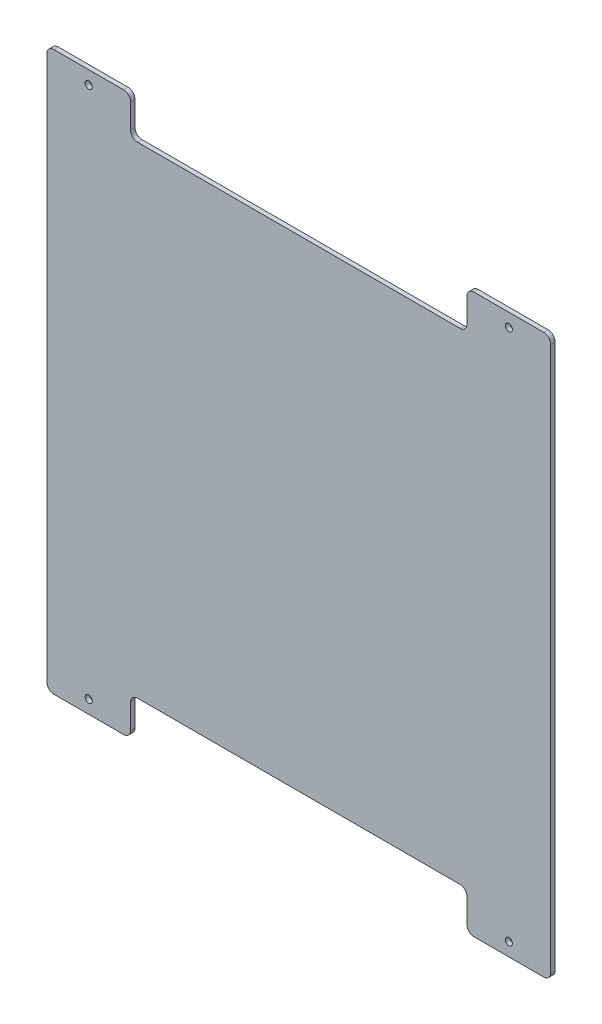
from build123d import *

# Parameters (mm, degrees)
BOSS_EXTRUDE1_DEPTH = 3.175
CUT_EXTRUDE1_REACH  = 271.426
SKETCH2_R           = 2.55


with BuildPart() as part:
    # Model → Boss-Extrude1 (new body)
    with BuildSketch(Plane.XY):
        with BuildLine():
            ThreePointArc((180.500000042, 195), (179.035533948, 198.535533906), (175.500000042, 200))
            Line((175.500000042, 200), (125.500000042, 200))
            ThreePointArc((125.500000042, 200), (121.964466136, 198.535533906), (120.500000042, 195))
            Line((120.500000042, 195), (120.500000042, 177.5))
            ThreePointArc((120.500000042, 177.5), (119.035533948, 173.964466094), (115.500000042, 172.5))
            Line((115.500000042, 172.5), (-115.500000042, 172.5))
            ThreePointArc((-115.500000042, 172.5), (-119.035533948, 173.964466094), (-120.500000042, 177.5))
            Line((-120.500000042, 177.5), (-120.500000042, 195))
            ThreePointArc((-120.500000042, 195), (-121.964466136, 198.535533906), (-125.500000042, 200))
            Line((-125.500000042, 200), (-175.500000042, 200))
            ThreePointArc((-175.500000042, 200), (-179.035533948, 198.535533906), (-180.500000042, 195))
            Line((-180.500000042, 195), (-180.500000042, -195))
            ThreePointArc((-180.500000042, -195), (-179.035533948, -198.535533906), (-175.500000042, -200))
            Line((-175.500000042, -200), (-125.500000042, -200))
            ThreePointArc((-125.500000042, -200), (-121.964466136, -198.535533906), (-120.500000042, -195))
            Line((-120.500000042, -195), (-120.500000042, -177.5))
            ThreePointArc((-120.500000042, -177.5), (-119.035533948, -173.964466094), (-115.500000042, -172.5))
            Line((-115.500000042, -172.5), (115.500000042, -172.5))
            ThreePointArc((115.500000042, -172.5), (119.035533948, -173.964466094), (120.500000042, -177.5))
            Line((120.500000042, -177.5), (120.500000042, -195))
            ThreePointArc((120.500000042, -195), (121.964466136, -198.535533906), (125.500000042, -200))
            Line((125.500000042, -200), (175.500000042, -200))
            ThreePointArc((175.500000042, -200), (179.035533948, -198.535533906), (180.500000042, -195))
            Line((180.500000042, -195), (180.500000042, 195))
        make_face()
    extrude(amount=BOSS_EXTRUDE1_DEPTH)

    # Sketch2 → Cut-Extrude1 (cut, up to next)
    with BuildSketch(Plane.XY.offset(3.175), mode=Mode.PRIVATE) as cut_extrude1_sk1:
        with Locations((-150.5, 190.5)):
            Circle(SKETCH2_R)
    cut_extrude1_tool1 = extrude(cut_extrude1_sk1.sketch, amount=-CUT_EXTRUDE1_REACH, mode=Mode.PRIVATE) & part.part
    # Sketch2 → Cut-Extrude1 (cut, up to next)
    with BuildSketch(Plane.XY.offset(3.175), mode=Mode.PRIVATE) as cut_extrude1_sk2:
        with Locations((150.5, 190.5)):
            Circle(SKETCH2_R)
    cut_extrude1_tool2 = extrude(cut_extrude1_sk2.sketch, amount=-CUT_EXTRUDE1_REACH, mode=Mode.PRIVATE) & part.part
    # Sketch2 → Cut-Extrude1 (cut, up to next)
    with BuildSketch(Plane.XY.offset(3.175), mode=Mode.PRIVATE) as cut_extrude1_sk3:
        with Locations((150.5, -190.5)):
            Circle(SKETCH2_R)
    cut_extrude1_tool3 = extrude(cut_extrude1_sk3.sketch, amount=-CUT_EXTRUDE1_REACH, mode=Mode.PRIVATE) & part.part
    # Sketch2 → Cut-Extrude1 (cut, up to next)
    with BuildSketch(Plane.XY.offset(3.175), mode=Mode.PRIVATE) as cut_extrude1_sk4:
        with Locations((-150.5, -190.5)):
            Circle(SKETCH2_R)
    cut_extrude1_tool4 = extrude(cut_extrude1_sk4.sketch, amount=-CUT_EXTRUDE1_REACH, mode=Mode.PRIVATE) & part.part
    add(cut_extrude1_tool1.solids().sort_by_distance((-150.5, 190.5, 3.175))[0], mode=Mode.SUBTRACT)
    add(cut_extrude1_tool2.solids().sort_by_distance((150.5, 190.5, 3.175))[0], mode=Mode.SUBTRACT)
    add(cut_extrude1_tool3.solids().sort_by_distance((150.5, -190.5, 3.175))[0], mode=Mode.SUBTRACT)
    add(cut_extrude1_tool4.solids().sort_by_distance((-150.5, -190.5, 3.175))[0], mode=Mode.SUBTRACT)


solid = part.part
